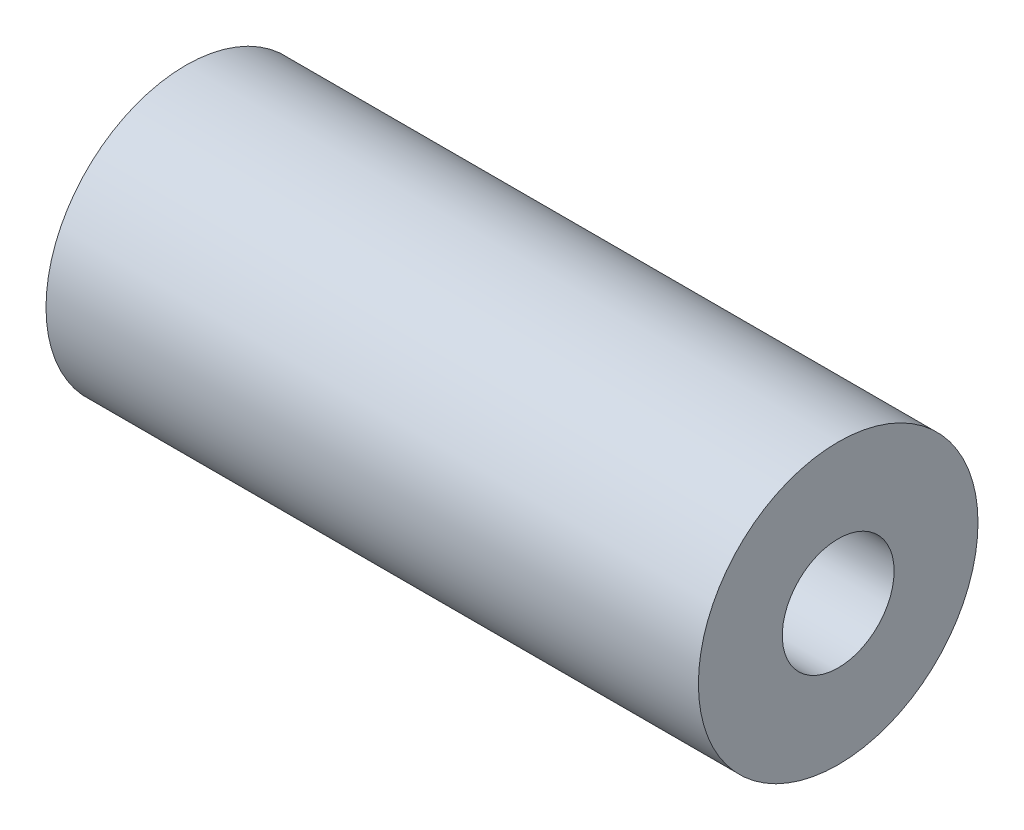
from build123d import *

# Parameters (mm, degrees)
CROQUIS1_R              = 60
CROQUIS1_R_2            = 24
SALIENTE_EXTRUIR1_DEPTH = 280


with BuildPart() as part:
    # Croquis1 → Saliente-Extruir1 (new body)
    with BuildSketch(Plane(origin=(0, 0, 0), x_dir=(0, 0, -1), z_dir=(1, 0, 0))):
        Circle(CROQUIS1_R)
        Circle(CROQUIS1_R_2, mode=Mode.SUBTRACT)
    extrude(amount=SALIENTE_EXTRUIR1_DEPTH)


solid = part.part
